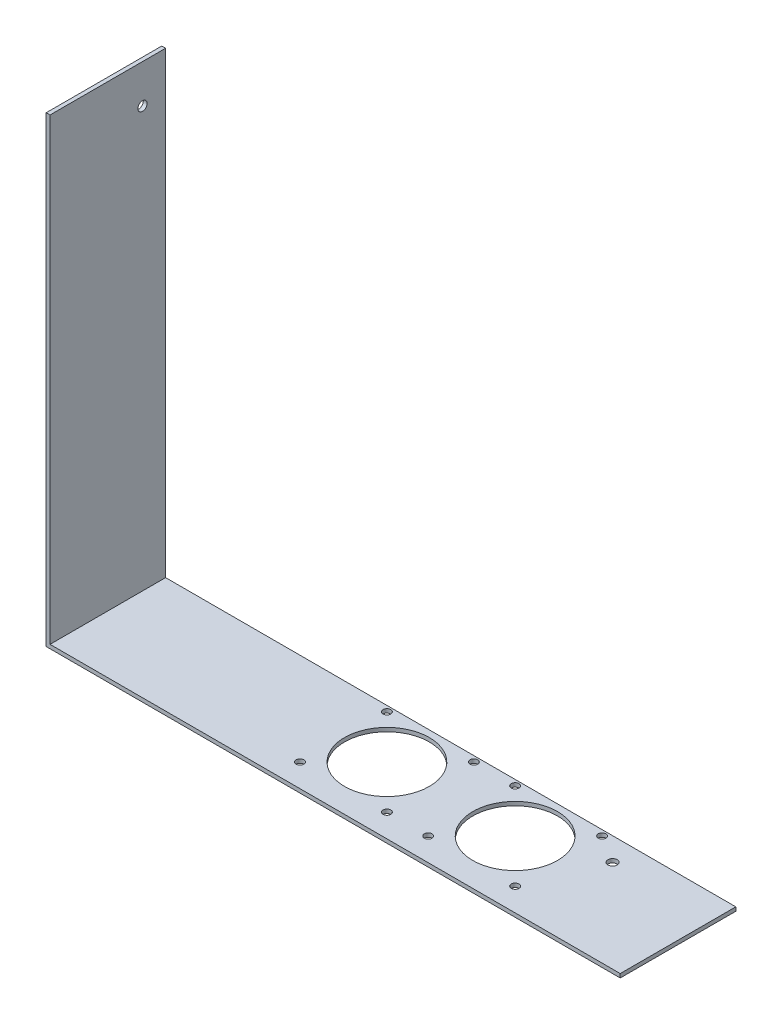
from build123d import *

# Parameters (mm, degrees)
BOSS_EXTRUDE1_DEPTH = 95.25
SKETCH2_R           = 3.175
CUT_EXTRUDE1_DEPTH  = 152.4
SKETCH4_R           = 34.925
SKETCH4_R_2         = 3.81
CUT_EXTRUDE2_DEPTH  = 381
SKETCH5_R           = 3.81
CUT_EXTRUDE3_DEPTH  = 12.7


with BuildPart() as part:
    # Sketch1 → Boss-Extrude1 (new body)
    with BuildSketch(Plane.XY):
        Polygon((0, 0), (0, 381), (3.175, 381), (3.175, 3.175), (473.075, 3.175), (473.075, 0), align=None)
    extrude(amount=BOSS_EXTRUDE1_DEPTH)

    # Sketch2 → Cut-Extrude1 (cut)
    with BuildSketch(Plane(origin=(0, 3.175, 0), x_dir=(1, 0, 0), z_dir=(0, 1, 0))):
        with Locations(Location((190.119, -4.572, 0), (0, 0, 180))):
            Circle(SKETCH2_R)
        with Locations(Location((190.119, -76.2, 0), (0, 0, 180))):
            Circle(SKETCH2_R)
        with Locations(Location((261.747, -4.572, 0), (0, 0, 180))):
            Circle(SKETCH2_R)
        with Locations(Location((261.747, -76.2, 0), (0, 0, 180))):
            Circle(SKETCH2_R)
        with Locations(Location((295.783, -76.2, 0), (0, 0, 180))):
            Circle(SKETCH2_R)
        with Locations(Location((295.783, -4.572, 0), (0, 0, 180))):
            Circle(SKETCH2_R)
        with Locations(Location((367.411, -76.2, 0), (0, 0, 180))):
            Circle(SKETCH2_R)
        with Locations(Location((367.411, -4.572, 0), (0, 0, 180))):
            Circle(SKETCH2_R)
    extrude(amount=-CUT_EXTRUDE1_DEPTH, mode=Mode.SUBTRACT)

    # Sketch4 → Cut-Extrude2 (cut)
    with BuildSketch(Plane.XZ):
        with Locations((225.933, 40.386)):
            Circle(SKETCH4_R)
        with Locations((331.597, 40.386)):
            Circle(SKETCH4_R)
        with Locations((390.525, 19.05)):
            Circle(SKETCH4_R_2)
    extrude(amount=-CUT_EXTRUDE2_DEPTH, mode=Mode.SUBTRACT)

    # Sketch5 → Cut-Extrude3 (cut)
    with BuildSketch(Plane.ZY):
        with Locations((19.05, 349.25)):
            Circle(SKETCH5_R)
    extrude(amount=-CUT_EXTRUDE3_DEPTH, mode=Mode.SUBTRACT)


solid = part.part
